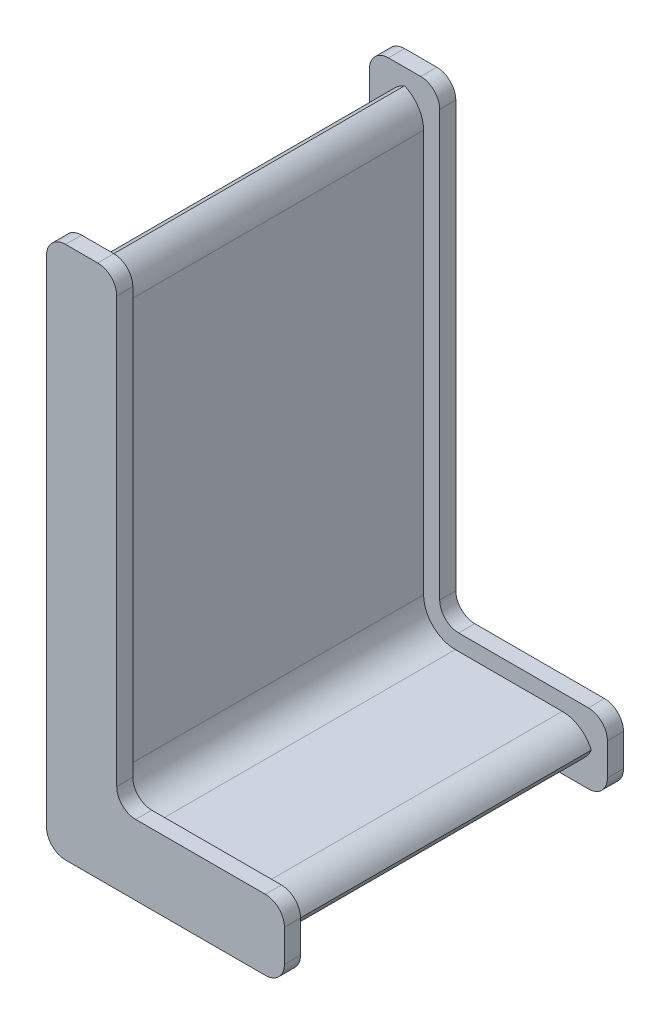
from build123d import *

# Parameters (mm, degrees)
BOSS_EXTRUDE1_DEPTH = 48.42
BOSS_EXTRUDE2_DEPTH = 2.54
BOSS_EXTRUDE3_DEPTH = 2.54
FILLET1_R           = 3


with BuildPart() as part:
    # Sketch2 → Boss-Extrude1 (new body)
    with BuildSketch(Plane.XY):
        with BuildLine():
            Line((0, 5), (0, 74.46))
            ThreePointArc((0, 74.46), (0.816699867, 77.198612788), (3, 79.042575695))
            ThreePointArc((3, 79.042575695), (5.183300133, 77.198612788), (6, 74.46))
            Line((6, 74.46), (6, 11))
            ThreePointArc((6, 11), (7.464466094, 7.464466094), (11, 6))
            Line((11, 6), (27.877424305, 6))
            ThreePointArc((27.877424305, 6), (30.616037093, 5.183300133), (32.46, 3))
            ThreePointArc((32.46, 3), (30.616037093, 0.816699867), (27.877424305, 0))
            Line((27.877424305, 0), (6, 0))
            Line((6, 0), (5, 0))
            ThreePointArc((5, 0), (1.464466094, 1.464466094), (0, 5))
        make_face()
    extrude(amount=BOSS_EXTRUDE1_DEPTH)

    # Sketch3 → Boss-Extrude2 (add)
    with BuildSketch(Plane.XY.offset(48.42)):
        Polygon((-2.54, 81.582575695), (8.54, 81.582575695), (8.54, 8.54), (35, 8.54), (35, -2.54), (-2.54, -2.54), align=None)
    extrude(amount=BOSS_EXTRUDE2_DEPTH)

    # Sketch4 → Boss-Extrude3 (add)
    with BuildSketch(Plane(origin=(0, 0, 0), x_dir=(-1, 0, 0), z_dir=(0, 0, -1))):
        Polygon((-35, -2.54), (2.54, -2.54), (2.54, 81.582575695), (-8.54, 81.582575695), (-8.54, 8.54), (-35, 8.54), align=None)
    extrude(amount=BOSS_EXTRUDE3_DEPTH)

    # Fillet1
    fillet1_edges = [part.edges().sort_by_distance(p)[0] for p in [
        (-2.54, 81.582575695, 49.69),
        (-2.54, -2.54, 49.69),
        (35, -2.54, 49.69),
        (35, 8.54, 49.69),
        (8.54, 8.54, 49.69),
        (8.54, 81.582575695, 49.69),
        (35, 8.54, -1.27),
        (35, -2.54, -1.27),
        (-2.54, -2.54, -1.27),
        (-2.54, 81.582575695, -1.27),
        (8.54, 81.582575695, -1.27),
        (8.54, 8.54, -1.27),
    ]]
    fillet(fillet1_edges, radius=FILLET1_R)


solid = part.part
